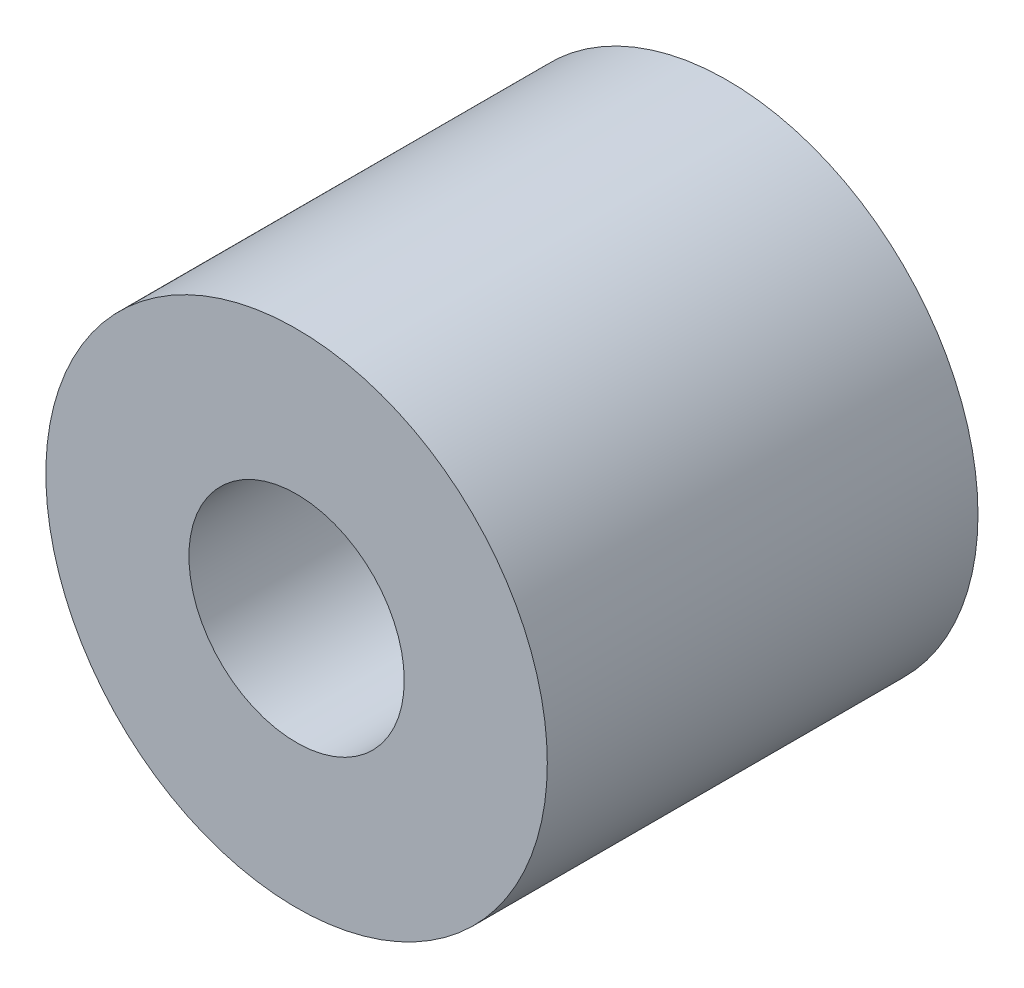
from build123d import *

# Parameters (mm, degrees)
SKETCH1_R           = 14.7875
SKETCH1_R_2         = 6.35
BOSS_EXTRUDE1_DEPTH = 25.4


with BuildPart() as part:
    # Sketch1 → Boss-Extrude1 (new body)
    with BuildSketch(Plane(origin=(0, 0, 0), x_dir=(0, 1, 0), z_dir=(0, 0, 1))):
        with Locations(Location((0, 0, 0), (0, 0, 270))):
            Circle(SKETCH1_R)
        with Locations(Location((0, 0, 0), (0, 0, 270))):
            Circle(SKETCH1_R_2, mode=Mode.SUBTRACT)
    extrude(amount=-BOSS_EXTRUDE1_DEPTH)


solid = part.part
